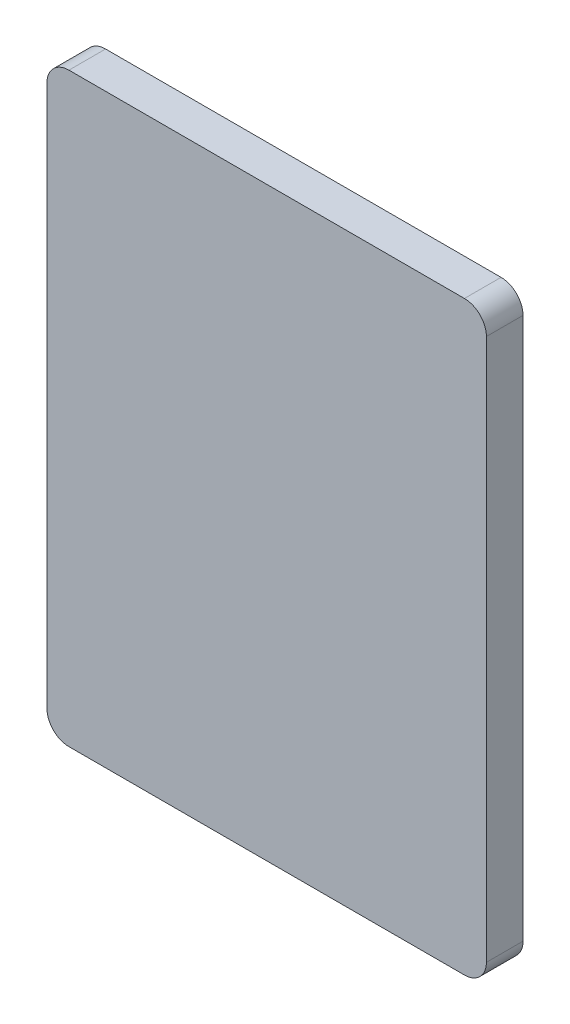
from build123d import *

# Parameters (mm, degrees)
SKETCH_1_W      = 60
SKETCH_1_H      = 80
EXTRUDE_1_DEPTH = 5
FILLET_1_R      = 3


with BuildPart() as part:
    # Эскиз1 → Бобышка-Вытянуть1 (new body)
    with BuildSketch(Plane.XY):
        Rectangle(SKETCH_1_W, SKETCH_1_H)
    extrude(amount=EXTRUDE_1_DEPTH)

    # Скругление1
    fillet_1_edges = [part.edges().sort_by_distance(p)[0] for p in [
        (-30, 40, 2.5),
        (30, 40, 2.5),
        (30, -40, 2.5),
        (-30, -40, 2.5),
    ]]
    fillet(fillet_1_edges, radius=FILLET_1_R)


solid = part.part
